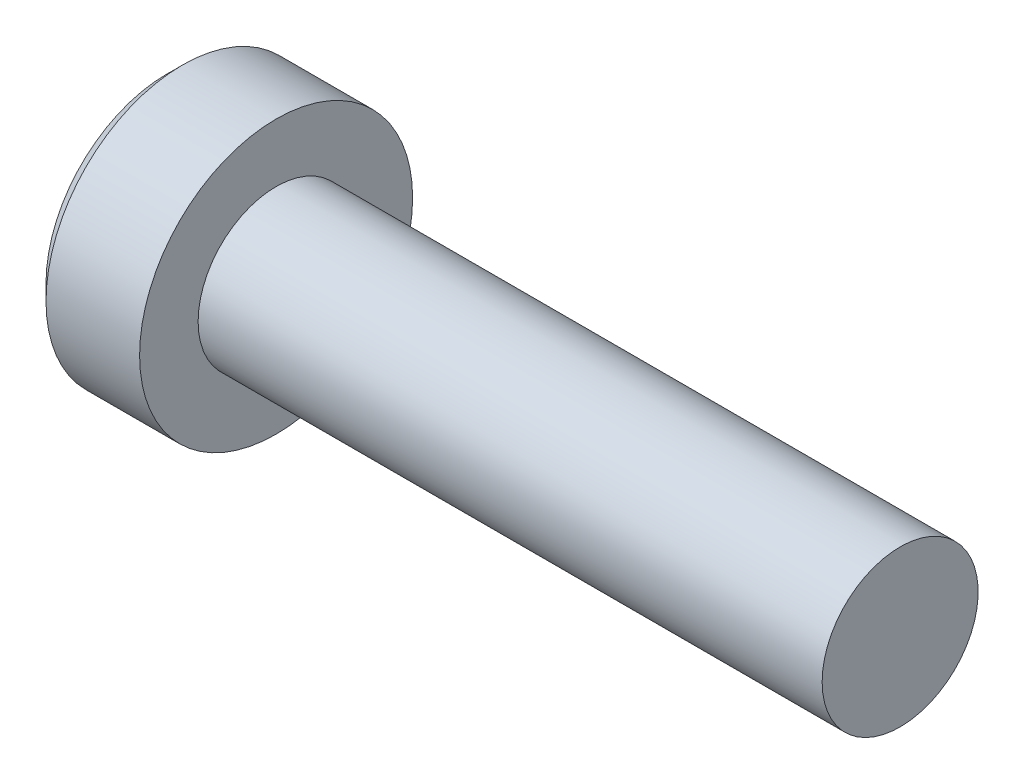
from build123d import *

# Parameters (mm, degrees)
CUT_EXTRUDE1_DEPTH = 2
CHAMFER1_SIZE      = 0.4


with BuildPart() as part:
    # Sketch1 → Revolve1 (revolve)
    with BuildSketch(Plane.XY, mode=Mode.PRIVATE) as revolve1_sk:
        Polygon((16, 0), (16, 2), (0, 2), (0, 3.5), (-2.8, 3.5), (-2.8, 0), align=None)
    revolve(revolve1_sk.sketch.rotate(Axis((-2.8, 0, 0), (1, 0, 0)), 90), axis=Axis((-2.8, 0, 0), (1, 0, 0)))

    # Sketch2 → Cut-Extrude1 (cut)
    with BuildSketch(Plane.ZY.offset(2.8)):
        Polygon((0, 1.732050808), (-1.5, 0.866025404), (-1.5, -0.866025404), (0, -1.732050808), (1.5, -0.866025404), (1.5, 0.866025404), align=None)
    extrude(amount=-CUT_EXTRUDE1_DEPTH, mode=Mode.SUBTRACT)

    # Sketch3 → Cut-Revolve1 (revolve, cut)
    with BuildSketch(Plane.XY, mode=Mode.PRIVATE) as cut_revolve1_sk:
        Polygon((0.066025404, 0), (-0.8, 1.5), (-0.8, 0), align=None)
    revolve(cut_revolve1_sk.sketch.rotate(Axis((-0.8, 0, 0), (1, 0, 0)), 90), axis=Axis((-0.8, 0, 0), (1, 0, 0)), mode=Mode.SUBTRACT)

    # Chamfer1
    chamfer1_edges = [part.edges().sort_by_distance(p)[0] for p in [
        (-2.8, 0, -3.5),
    ]]
    chamfer(chamfer1_edges, length=CHAMFER1_SIZE)


solid = part.part
